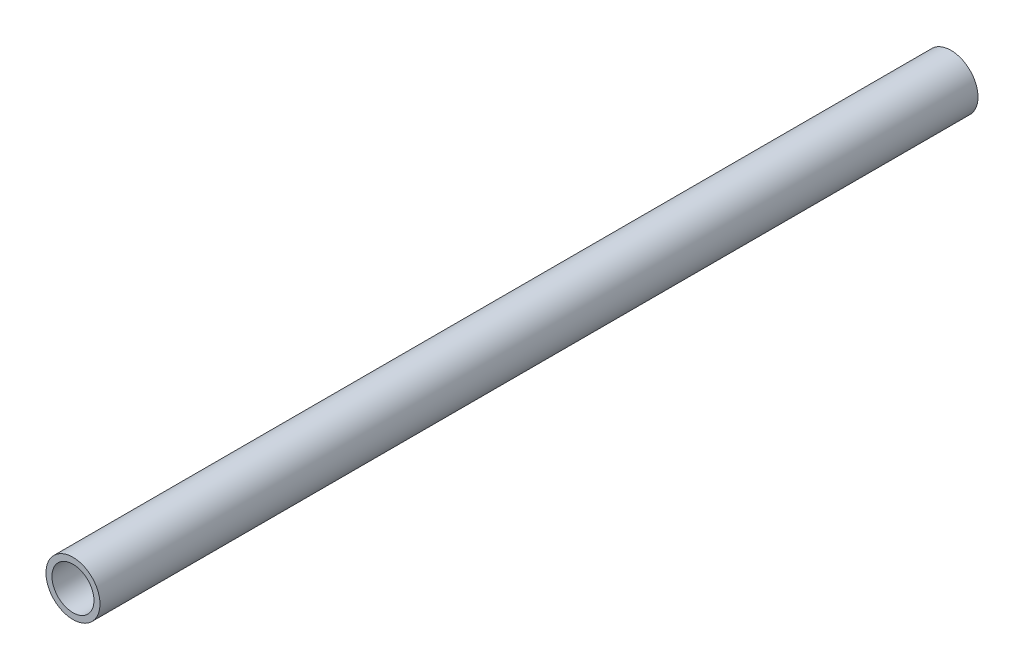
from build123d import *

# Parameters (mm, degrees)
SKETCH1_R           = 9
SKETCH1_R_2         = 7
BOSS_EXTRUDE1_DEPTH = 292.66


with BuildPart() as part:
    # Sketch1 → Boss-Extrude1 (new body)
    with BuildSketch(Plane.XY):
        Circle(SKETCH1_R)
        Circle(SKETCH1_R_2, mode=Mode.SUBTRACT)
    extrude(amount=BOSS_EXTRUDE1_DEPTH)


solid = part.part
